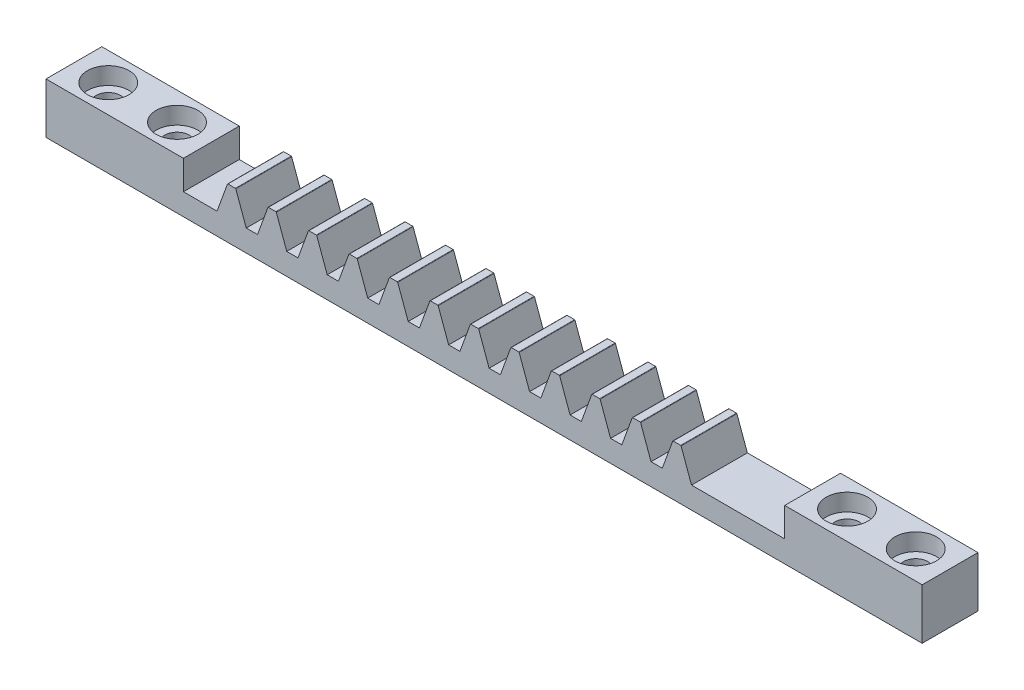
from build123d import *

# Parameters (mm, degrees)
BLANKSKE_W          = 56.5
BLANKSKE_H          = 6
BLANK_DEPTH         = 6.5
TOOTHCUTILL_DEPTH   = 58.188285514
TOOTHCUTSIM_DEPTH   = 58.188285514
TEETHCUTS_COUNT     = 13
TEETHCUTS_PITCH     = 4.712388975
SKETCH_4_W          = 19.255
SKETCH_4_H          = 6.5
SKETCH_4_W_2        = 26.245
EXTRUDE_1_DEPTH     = 2.625
SKETCH_5_W          = 16
SKETCH_5_H          = 6.5
EXTRUDE_2_DEPTH     = 3.375
SKETCH_8_R          = 1.425
CUT_EXTRUDE_1_DEPTH = 84.216494909
SKETCH_11_R         = 2.425
SKETCH_11_R_2       = 1.425
CUT_EXTRUDE_2_DEPTH = 2
CUT_EXTRUDE_START   = -0.1
SKETCH_14_W         = 102
SKETCH_14_H         = 6.5
SKETCH_14_R         = 1.425
CUT_EXTRUDE_3_DEPTH = 0.1


with BuildPart() as part:
    # BlankSke → Blank (new body)
    with BuildSketch(Plane.XY):
        with Locations((28.25, 3)):
            Rectangle(BLANKSKE_W, BLANKSKE_H)
    extrude(amount=-BLANK_DEPTH)

    # TooCutSkeIll → ToothCutIll (cut, through all)
    with BuildSketch(Plane.XY):
        with BuildLine():
            Line((-1.86868349, 5.960521209), (-0.744699446, 2.872400426))
            ThreePointArc((-0.744699446, 2.872400426), (-0.60703976, 2.692998831), (-0.39137502, 2.625))
            Line((-0.39137502, 2.625), (0.39137502, 2.625))
            ThreePointArc((0.39137502, 2.625), (0.60703976, 2.692998831), (0.744699446, 2.872400426))
            Line((0.744699446, 2.872400426), (1.86868349, 5.960521209))
            ThreePointArc((1.86868349, 5.960521209), (1.890650461, 5.989149123), (1.925065047, 6))
            Line((1.925065047, 6), (1.925065047, 6.0254))
            Line((1.925065047, 6.0254), (-1.925065047, 6.0254))
            Line((-1.925065047, 6.0254), (-1.925065047, 6))
            ThreePointArc((-1.925065047, 6), (-1.890650461, 5.989149123), (-1.86868349, 5.960521209))
        make_face()
    toothcutill = extrude(amount=-TOOTHCUTILL_DEPTH, mode=Mode.SUBTRACT)

    # TooCutSkeSim → ToothCutSim (cut, through all)
    with BuildSketch(Plane.XY):
        Polygon((0.654653055, 2.625), (-0.654653055, 2.625), (-1.892297439, 6.0254), (1.892297439, 6.0254), align=None)
    toothcutsim = extrude(amount=-TOOTHCUTSIM_DEPTH, mode=Mode.SUBTRACT)

    # TeethCuts: ToothCutIll, ToothCutSim ×13
    with Locations(*[(i * TEETHCUTS_PITCH, 0, 0) for i in range(1, TEETHCUTS_COUNT)]):
        add(toothcutill, mode=Mode.SUBTRACT)
        add(toothcutsim, mode=Mode.SUBTRACT)

    # 草图4 → 凸台-拉伸1 (add)
    with BuildSketch(Plane(origin=(0, 0, 0), x_dir=(-1, 0, 0), z_dir=(0, -1, 0))):
        with Locations((9.6275, 3.25)):
            Rectangle(SKETCH_4_W, SKETCH_4_H)
        with Locations((-69.6225, 3.25)):
            Rectangle(SKETCH_4_W_2, SKETCH_4_H)
    extrude(amount=-EXTRUDE_1_DEPTH)

    # 草图5 → 凸台-拉伸2 (add)
    with BuildSketch(Plane(origin=(0, 2.625, 0), x_dir=(1, 0, 0), z_dir=(0, 1, 0))):
        with Locations((-11.255, 3.25)):
            Rectangle(SKETCH_5_W, SKETCH_5_H)
        with Locations((74.745, 3.25)):
            Rectangle(SKETCH_5_W, SKETCH_5_H)
    extrude(amount=EXTRUDE_2_DEPTH)

    # 草图8 → 切除-拉伸1 (cut, through all)
    with BuildSketch(Plane(origin=(0, 6, 0), x_dir=(1, 0, 0), z_dir=(0, 1, 0))):
        with Locations(Location((-15.255, 3.25, 0), (0, 0, 270))):
            Circle(SKETCH_8_R)
        with Locations(Location((-7.255, 3.25, 0), (0, 0, 270))):
            Circle(SKETCH_8_R)
        with Locations(Location((78.745, 3.25, 0), (0, 0, 270))):
            Circle(SKETCH_8_R)
        with Locations(Location((70.745, 3.25, 0), (0, 0, 270))):
            Circle(SKETCH_8_R)
    extrude(amount=-CUT_EXTRUDE_1_DEPTH, mode=Mode.SUBTRACT)

    # 草图11 → 切除-拉伸2 (cut)
    # profile 1 of 4: a face of its own
    with BuildSketch(Plane(origin=(0, 6, 0), x_dir=(1, 0, 0), z_dir=(0, 1, 0))):
        with Locations(Location((70.745, 3.25, 0), (0, 0, 270))):
            Circle(SKETCH_11_R)
        with Locations(Location((70.745, 3.25, 0), (0, 0, 270))):
            Circle(SKETCH_11_R_2, mode=Mode.SUBTRACT)
    # profile 2 of 4: a face of its own
    with BuildSketch(Plane(origin=(0, 6, 0), x_dir=(1, 0, 0), z_dir=(0, 1, 0))):
        with Locations(Location((78.745, 3.25, 0), (0, 0, 270))):
            Circle(SKETCH_11_R)
        with Locations(Location((78.745, 3.25, 0), (0, 0, 270))):
            Circle(SKETCH_11_R_2, mode=Mode.SUBTRACT)
    # profile 3 of 4: a face of its own
    with BuildSketch(Plane(origin=(0, 6, 0), x_dir=(1, 0, 0), z_dir=(0, 1, 0))):
        with Locations(Location((-7.255, 3.25, 0), (0, 0, 270))):
            Circle(SKETCH_11_R)
        with Locations(Location((-7.255, 3.25, 0), (0, 0, 270))):
            Circle(SKETCH_11_R_2, mode=Mode.SUBTRACT)
    # profile 4 of 4: a face of its own
    with BuildSketch(Plane(origin=(0, 6, 0), x_dir=(1, 0, 0), z_dir=(0, 1, 0))):
        with Locations(Location((-15.255, 3.25, 0), (0, 0, 270))):
            Circle(SKETCH_11_R)
        with Locations(Location((-15.255, 3.25, 0), (0, 0, 270))):
            Circle(SKETCH_11_R_2, mode=Mode.SUBTRACT)
    extrude(amount=-CUT_EXTRUDE_2_DEPTH, mode=Mode.SUBTRACT)

    # 草图14 → 切除-拉伸3 (cut)
    with BuildSketch(Plane(origin=(0, 0, 0), x_dir=(-1, 0, 0), z_dir=(0, -1, 0)).offset(CUT_EXTRUDE_START)):
        with Locations((-31.745, 3.25)):
            Rectangle(SKETCH_14_W, SKETCH_14_H)
        with Locations(Location((15.255, 3.25, 0), (0, 0, 270))):
            Circle(SKETCH_14_R, mode=Mode.SUBTRACT)
        with Locations(Location((7.255, 3.25, 0), (0, 0, 270))):
            Circle(SKETCH_14_R, mode=Mode.SUBTRACT)
        with Locations(Location((-70.745, 3.25, 0), (0, 0, 270))):
            Circle(SKETCH_14_R, mode=Mode.SUBTRACT)
        with Locations(Location((-78.745, 3.25, 0), (0, 0, 270))):
            Circle(SKETCH_14_R, mode=Mode.SUBTRACT)
    extrude(amount=CUT_EXTRUDE_3_DEPTH, mode=Mode.SUBTRACT)


solid = part.part
